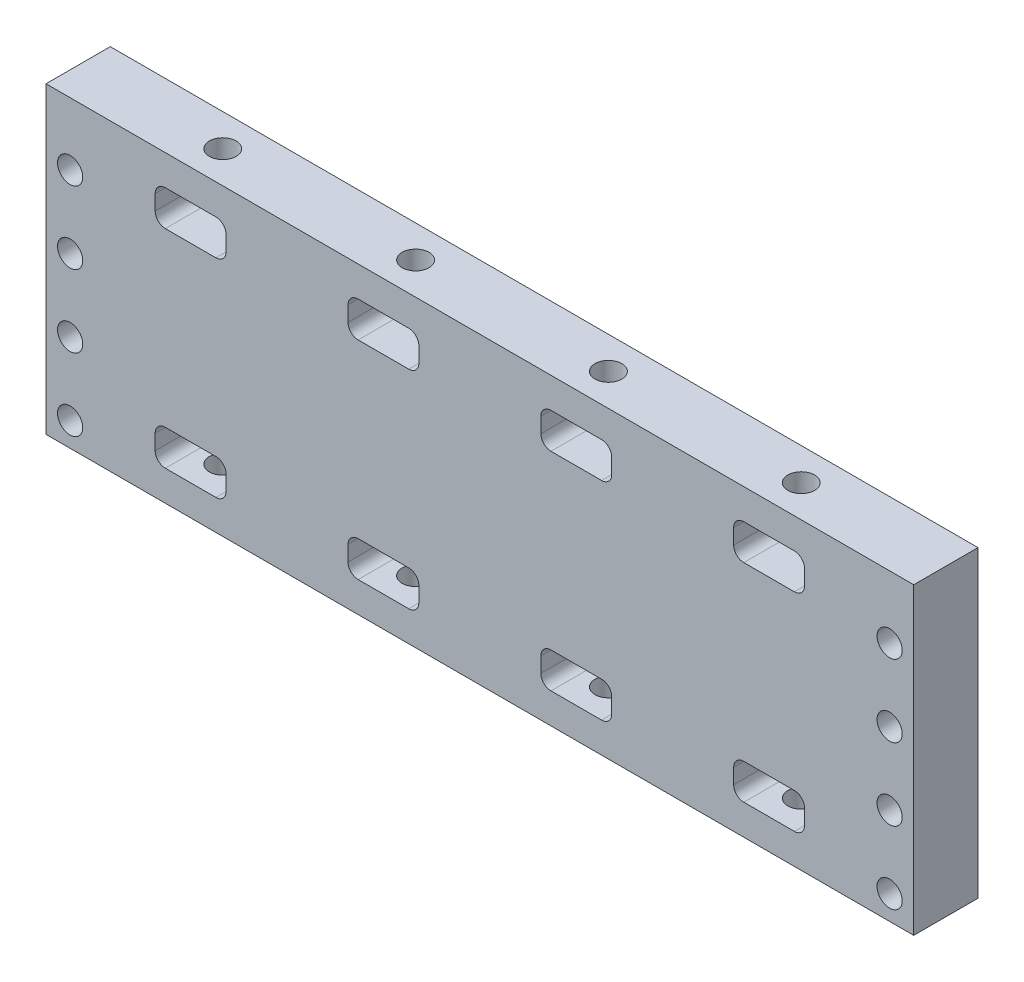
from build123d import *

# Parameters (mm, degrees)
SKETCH1_W                    = 171.45
SKETCH1_H                    = 60
BOSS_EXTRUDE1_DEPTH          = 6.35
F_10_CLEARANCE_HOLE1_D       = 4.9784
SKETCH12_W                   = 14
SKETCH12_H                   = 7
CUT_EXTRUDE4_DEPTH           = 92.706409945
FILLET2_R                    = 2
FILLET2_OF_SKETCH_PATTERN1_R = 2
M5_CLEARANCE_HOLE2_D         = 5.3
M5_CLEARANCE_HOLE2_DEPTH     = 6
M5_CLEARANCE_HOLE3_D         = 5.3
M5_CLEARANCE_HOLE3_DEPTH     = 6


with BuildPart() as part:
    # Sketch1 → Boss-Extrude1 (new, symmetric)
    with BuildSketch(Plane.XY):
        Rectangle(SKETCH1_W, SKETCH1_H)
    extrude(amount=BOSS_EXTRUDE1_DEPTH, both=True)

    # #10 Clearance Hole1 (through all)
    with Locations(Plane.XY.offset(6.35)):
        with Locations((-80.9625, 17.625), (-80.9625, 3.3375), (-80.9625, -10.95), (-80.9625, -25.2375), (80.9625, 17.625), (80.9625, 3.3375), (80.9625, -10.95), (80.9625, -25.2375)):
            Hole(F_10_CLEARANCE_HOLE1_D / 2)

    # Sketch12 → Cut-Extrude4 (cut, through all)
    with BuildSketch(Plane.XY.offset(6.35)):
        with Locations((-57.15, 20.5)):
            Rectangle(SKETCH12_W, SKETCH12_H)
    cut_extrude4 = extrude(amount=-CUT_EXTRUDE4_DEPTH, mode=Mode.SUBTRACT)

    # Fillet2
    fillet2_edges = [part.edges().sort_by_distance(p)[0] for p in [
        (-50.15, 24, 0),
        (-50.15, 17, 0),
        (-64.15, 17, 0),
        (-64.15, 24, 0),
    ]]
    fillet(fillet2_edges, radius=FILLET2_R)

    # Sketch-Pattern1: Cut-Extrude4 at 7 more places
    with Locations((38.1, 0, 0), (76.2, 0, 0), (114.3, 0, 0), (114.3, -41, 0), (76.2, -41, 0), (0, -41, 0), (38.1, -41, 0)):
        add(cut_extrude4, mode=Mode.SUBTRACT)

    # Fillet2 of Sketch-Pattern1
    fillet2_of_sketch_pattern1_edges = [part.edges().sort_by_distance(p)[0] for p in [
        (-12.05, 24, 0),
        (-12.05, 17, 0),
        (-26.05, 17, 0),
        (-26.05, 24, 0),
        (26.05, 24, 0),
        (26.05, 17, 0),
        (12.05, 17, 0),
        (12.05, 24, 0),
        (64.15, 24, 0),
        (64.15, 17, 0),
        (50.15, 17, 0),
        (50.15, 24, 0),
        (64.15, -17, 0),
        (64.15, -24, 0),
        (50.15, -24, 0),
        (50.15, -17, 0),
        (26.05, -17, 0),
        (26.05, -24, 0),
        (12.05, -24, 0),
        (12.05, -17, 0),
        (-50.15, -17, 0),
        (-50.15, -24, 0),
        (-64.15, -24, 0),
        (-64.15, -17, 0),
        (-12.05, -17, 0),
        (-12.05, -24, 0),
        (-26.05, -24, 0),
        (-26.05, -17, 0),
    ]]
    fillet(fillet2_of_sketch_pattern1_edges, radius=FILLET2_OF_SKETCH_PATTERN1_R)

    # M5 Clearance Hole2
    with Locations(Plane(origin=(0, 30, 0), x_dir=(1, 0, 0), z_dir=(0, 1, 0))):
        with Locations((-57.15, 0), (-19.05, 0), (19.05, 0), (57.15, 0)):
            Hole(M5_CLEARANCE_HOLE2_D / 2, depth=M5_CLEARANCE_HOLE2_DEPTH)

    # M5 Clearance Hole3
    with Locations(Plane(origin=(0, -30, 0), x_dir=(-1, 0, 0), z_dir=(0, -1, 0))):
        with Locations((-57.15, 0), (-19.05, 0), (19.05, 0), (57.15, 0)):
            Hole(M5_CLEARANCE_HOLE3_D / 2, depth=M5_CLEARANCE_HOLE3_DEPTH)


solid = part.part
